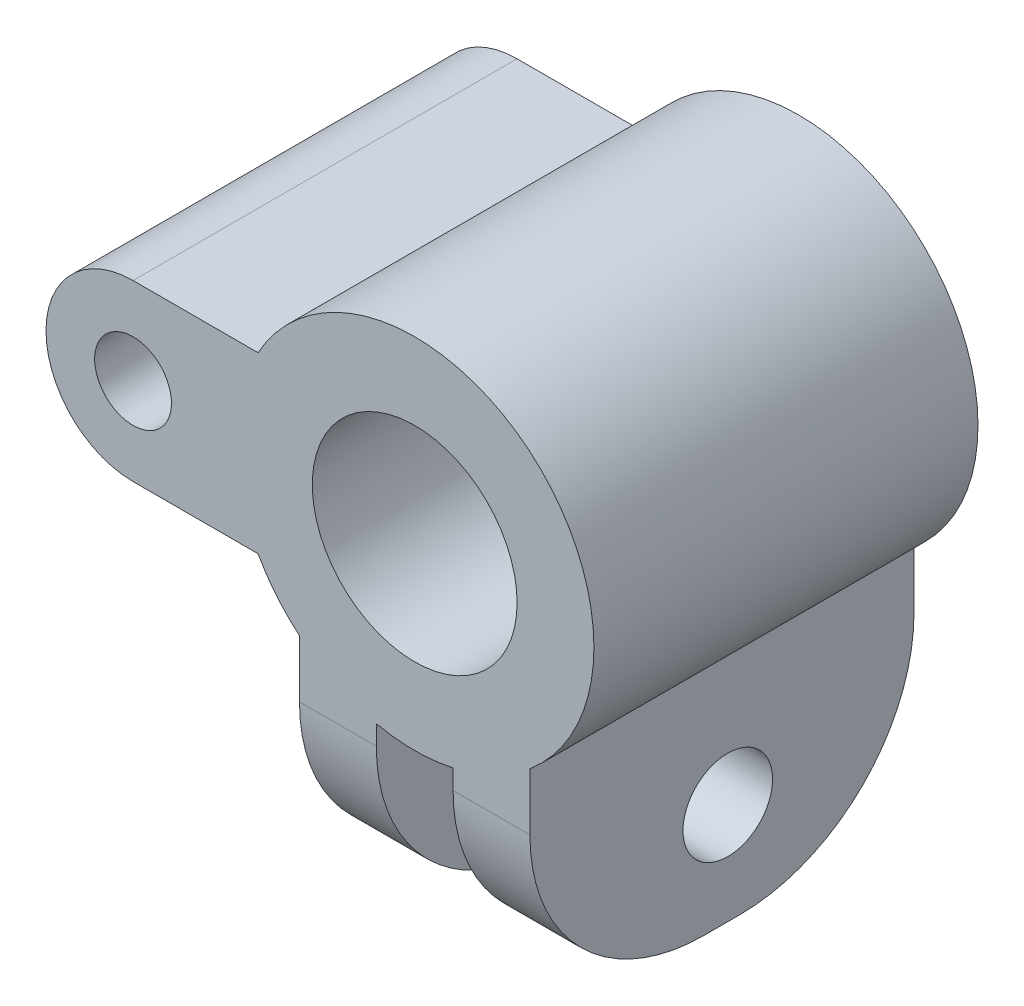
from build123d import *

# Parameters (mm, degrees)
SKETCH1_R           = 7.5
SKETCH1_R_2         = 20
BOSS_EXTRUDE1_DEPTH = 75
BOSS_EXTRUDE2_DEPTH = 75
FILLET6_R           = 34
FILLET8_R           = 34
SKETCH3_R           = 8.750256672
CUT_EXTRUDE1_DEPTH  = 15


with BuildPart() as part:
    # Sketch1 → Boss-Extrude1 (new body)
    with BuildSketch(Plane.XY):
        with BuildLine():
            Line((-55, -17), (-30.594117082, -17))
            ThreePointArc((-30.594117082, -17), (35, 0), (-30.594117082, 17))
            Line((-30.594117082, 17), (-55, 17))
            ThreePointArc((-55, 17), (-72, 0), (-55, -17))
        make_face()
        with Locations((-55, 0)):
            Circle(SKETCH1_R, mode=Mode.SUBTRACT)
        Circle(SKETCH1_R_2, mode=Mode.SUBTRACT)
    extrude(amount=BOSS_EXTRUDE1_DEPTH)

    # Sketch1<12> → Boss-Extrude2 (add)
    with BuildSketch(Plane.XY):
        with BuildLine():
            Line((22.5, -72), (22.5, -26.809513237))
            ThreePointArc((22.5, -26.809513237), (15.446901808, -31.406897722), (7.5, -34.186985828))
            Line((7.5, -34.186985828), (7.5, -72))
            Line((7.5, -72), (22.5, -72))
        make_face()
        with BuildLine():
            ThreePointArc((-7.5, -34.186985828), (-15.446901808, -31.406897722), (-22.5, -26.809513237))
            Line((-22.5, -26.809513237), (-22.5, -72))
            Line((-22.5, -72), (-7.5, -72))
            Line((-7.5, -72), (-7.5, -34.186985828))
        make_face()
    extrude(amount=BOSS_EXTRUDE2_DEPTH)

    # Fillet6
    fillet6_edges = [part.edges().sort_by_distance(p)[0] for p in [
        (-15, -72, 0),
        (-15, -72, 75),
    ]]
    fillet(fillet6_edges, radius=FILLET6_R)

    # Fillet8
    fillet8_edges = [part.edges().sort_by_distance(p)[0] for p in [
        (15, -72, 0),
        (15, -72, 75),
    ]]
    fillet(fillet8_edges, radius=FILLET8_R)

    # Sketch3 → Cut-Extrude1 (cut)
    with BuildSketch(Plane(origin=(22.5, 0, 0), x_dir=(0, 0, -1), z_dir=(1, 0, 0))):
        with Locations((-36.363077214, -52.246350357)):
            Circle(SKETCH3_R)
    cut_extrude1 = extrude(amount=-CUT_EXTRUDE1_DEPTH, mode=Mode.SUBTRACT)

    # Mirror2: Cut-Extrude1 across plane
    add(cut_extrude1.mirror(Plane(origin=(0, 0, 0), x_dir=(0, 0, 1), z_dir=(1, 0, 0))), mode=Mode.SUBTRACT)


solid = part.part
